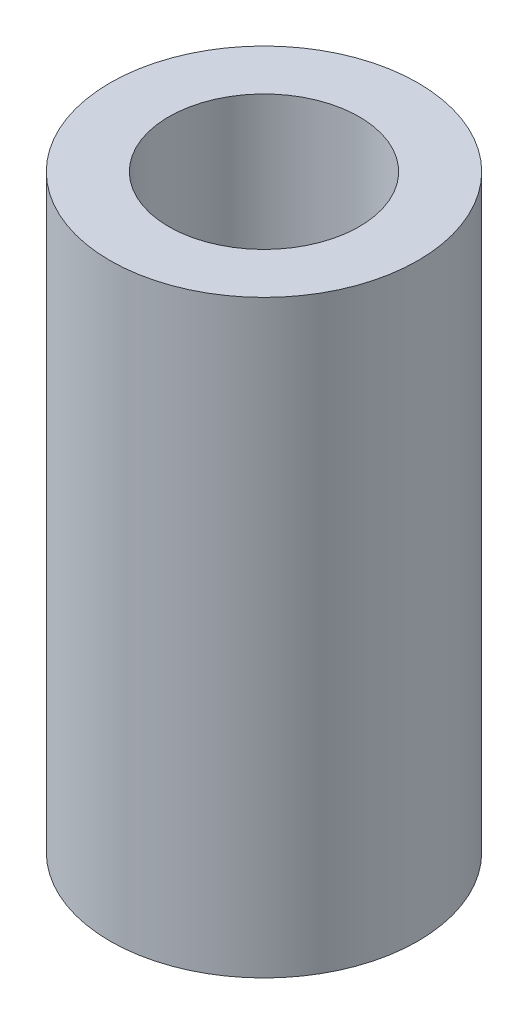
from build123d import *

# Parameters (mm, degrees)
SKETCH1_R           = 4.445
BOSS_EXTRUDE1_DEPTH = 17.018
SKETCH1_3_R         = 2.75
CUT_EXTRUDE1_DEPTH  = 19.141895546


with BuildPart() as part:
    # Sketch1 → Boss-Extrude1 (new body)
    with BuildSketch(Plane(origin=(0, 0, 0), x_dir=(1, 0, 0), z_dir=(0, 1, 0))):
        Circle(SKETCH1_R)
    extrude(amount=BOSS_EXTRUDE1_DEPTH)

    # Sketch1<3> → Cut-Extrude1 (cut, through all)
    with BuildSketch(Plane(origin=(0, 0, 0), x_dir=(1, 0, 0), z_dir=(0, 1, 0))):
        Circle(SKETCH1_3_R)
    extrude(amount=CUT_EXTRUDE1_DEPTH, mode=Mode.SUBTRACT)


solid = part.part
